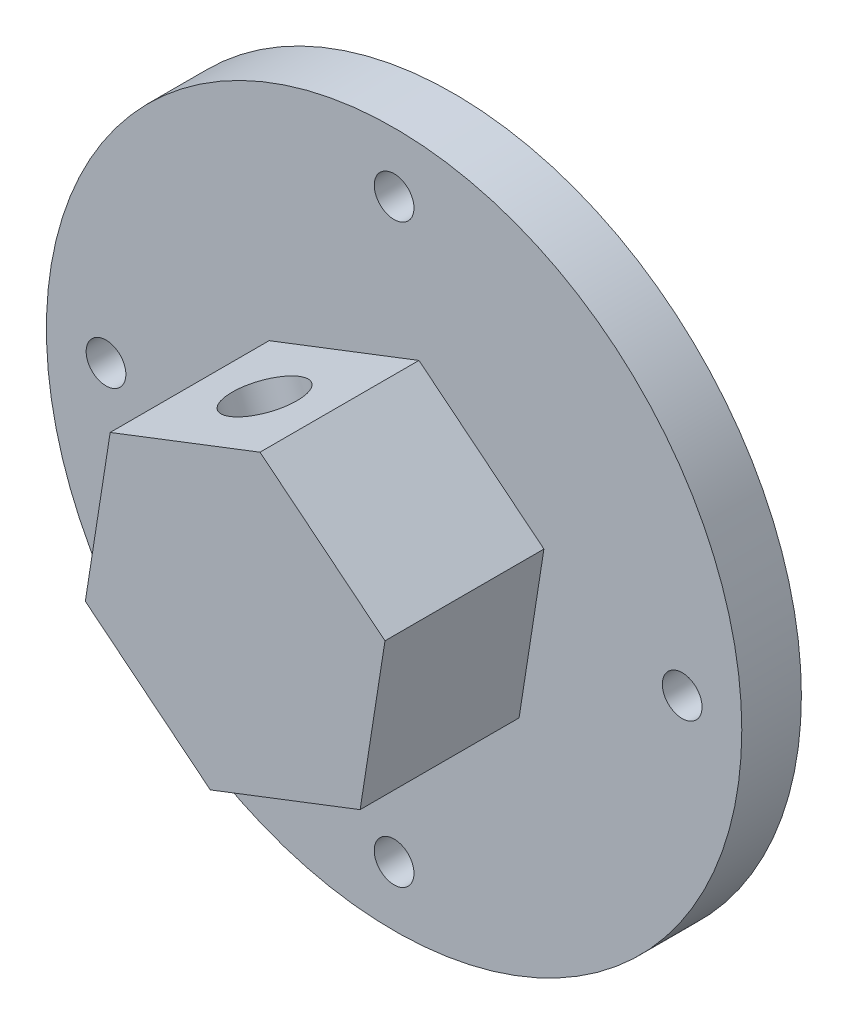
from build123d import *

# Parameters (mm, degrees)
CROQUIS1_R              = 17.5
CROQUIS1_R_2            = 1
SALIENTE_EXTRUIR1_DEPTH = 3
SALIENTE_EXTRUIR2_DEPTH = 8
CORTAR_EXTRUIR1_REACH   = 35.155
CROQUIS3_R              = 1.75


with BuildPart() as part:
    # Croquis1 → Saliente-Extruir1 (new body)
    with BuildSketch(Plane.XY):
        Circle(CROQUIS1_R)
        with Locations((0, 14.5)):
            Circle(CROQUIS1_R_2, mode=Mode.SUBTRACT)
        with Locations((14.5, 0)):
            Circle(CROQUIS1_R_2, mode=Mode.SUBTRACT)
        with Locations((0, -14.5)):
            Circle(CROQUIS1_R_2, mode=Mode.SUBTRACT)
        with Locations((-14.5, 0)):
            Circle(CROQUIS1_R_2, mode=Mode.SUBTRACT)
    extrude(amount=SALIENTE_EXTRUIR1_DEPTH)

    # Croquis2 → Saliente-Extruir2 (add)
    with BuildSketch(Plane.XY.offset(3)):
        Polygon((1.250794552, 7.985539827), (-6.290283076, 5.075989771), (-7.541077629, -2.909550056), (-1.250794552, -7.985539827), (6.290283076, -5.075989771), (7.541077629, 2.909550056), align=None)
    extrude(amount=SALIENTE_EXTRUIR2_DEPTH)

    # Croquis3 → Cortar-Extruir1 (cut, up to next)
    with BuildSketch(Plane(origin=(2.519744262, -6.530764799, 0), x_dir=(0.9329663997946839, 0.35996346599918455, 0), z_dir=(0.35996346599918455, -0.9329663997946839, 0)), mode=Mode.PRIVATE) as cortar_extruir1_sk1:
        with Locations((0, 7)):
            Circle(CROQUIS3_R)
    cortar_extruir1_tool1 = extrude(cortar_extruir1_sk1.sketch, amount=-CORTAR_EXTRUIR1_REACH, mode=Mode.PRIVATE) & part.part
    add(cortar_extruir1_tool1.solids().sort_by_distance((2.519744, -6.530765, 7))[0], mode=Mode.SUBTRACT)


solid = part.part
